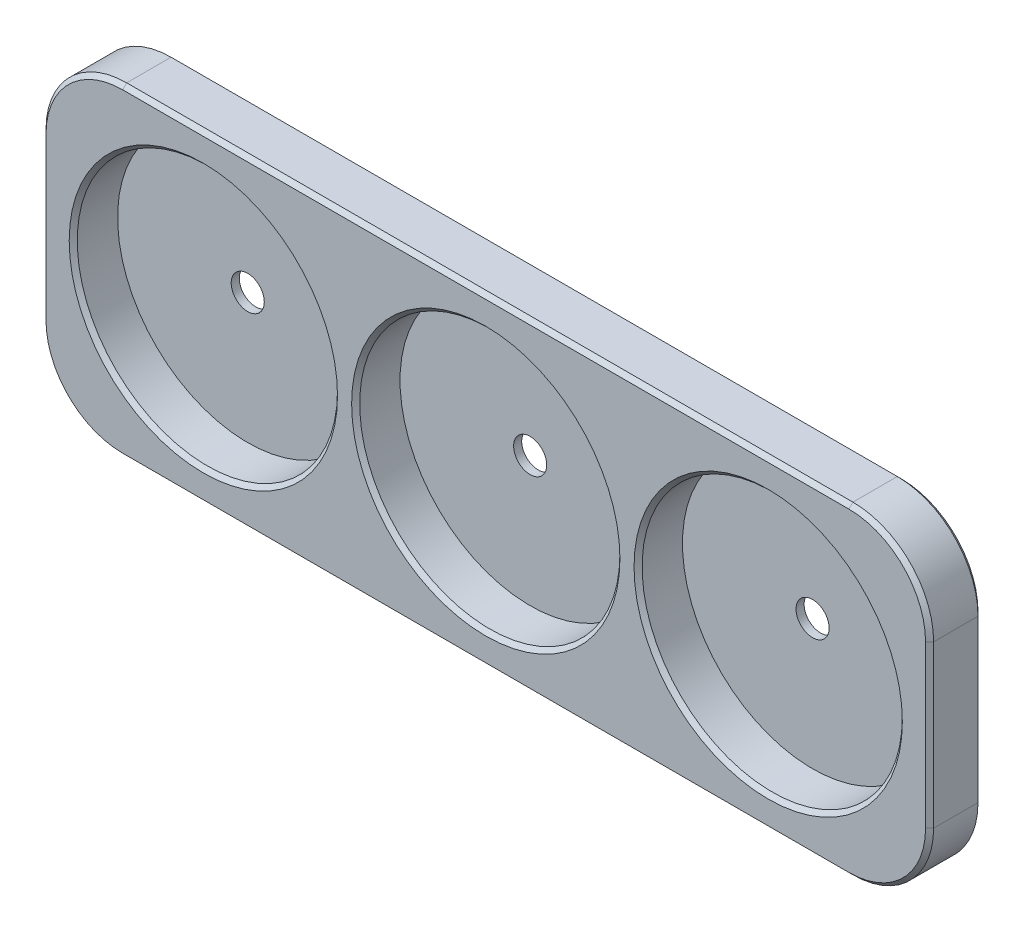
from build123d import *

# Parameters (mm, degrees)
SKETCH1_W           = 110
SKETCH1_H           = 40
BOSS_EXTRUDE1_DEPTH = 6.5
SKETCH2_R           = 16.125
CUT_EXTRUDE1_DEPTH  = 5.5
FILLET1_R           = 10
SKETCH3_R           = 2.05
CUT_EXTRUDE2_DEPTH  = 59.781374601
CHAMFER1_SIZE       = 0.5


with BuildPart() as part:
    # Sketch1 → Boss-Extrude1 (new body)
    with BuildSketch(Plane.XY):
        Rectangle(SKETCH1_W, SKETCH1_H)
    extrude(amount=BOSS_EXTRUDE1_DEPTH)

    # Sketch2 → Cut-Extrude1 (cut)
    with BuildSketch(Plane.XY.offset(6.5)):
        Circle(SKETCH2_R)
        with Locations((35, 0)):
            Circle(SKETCH2_R)
        with Locations((-35, 0)):
            Circle(SKETCH2_R)
    extrude(amount=-CUT_EXTRUDE1_DEPTH, mode=Mode.SUBTRACT)

    # Fillet1
    fillet1_edges = [part.edges().sort_by_distance(p)[0] for p in [
        (55, -20, 3.25),
        (-55, -20, 3.25),
        (-55, 20, 3.25),
        (55, 20, 3.25),
    ]]
    fillet(fillet1_edges, radius=FILLET1_R)

    # Sketch3 → Cut-Extrude2 (cut, through all)
    with BuildSketch(Plane.XY.offset(1)):
        Circle(SKETCH3_R)
        with Locations((35, 0)):
            Circle(SKETCH3_R)
        with Locations((-35, 0)):
            Circle(SKETCH3_R)
    extrude(amount=-CUT_EXTRUDE2_DEPTH, mode=Mode.SUBTRACT)

    # Chamfer1
    chamfer1_edges = [part.edges().sort_by_distance(p)[0] for p in [
        (-51.125, 0, 6.5),
        (18.875, 0, 6.5),
        (-16.125, 0, 6.5),
        (55, 0, 0),
        (55, 0, 6.5),
        (0, -20, 0),
        (-55, 0, 0),
        (0, 20, 0),
        (-52.071067812, -17.071067812, 0),
        (-52.071067812, 17.071067812, 0),
        (52.071067812, 17.071067812, 0),
        (52.071067812, -17.071067812, 0),
        (0, -20, 6.5),
        (0, 20, 6.5),
        (-55, 0, 6.5),
        (-52.071067812, -17.071067812, 6.5),
        (-52.071067812, 17.071067812, 6.5),
        (52.071067812, 17.071067812, 6.5),
        (52.071067812, -17.071067812, 6.5),
    ]]
    chamfer(chamfer1_edges, length=CHAMFER1_SIZE)


solid = part.part
